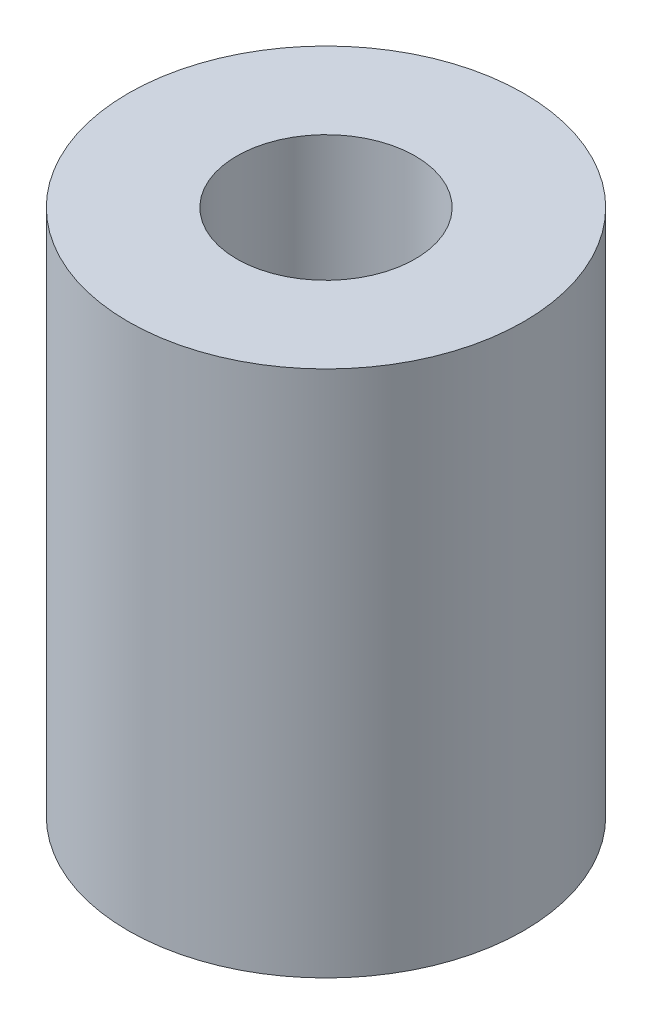
from build123d import *

# Parameters (mm, degrees)
SKETCH1_R           = 11.083333333
SKETCH1_R_2         = 5
BOSS_EXTRUDE3_DEPTH = 14.777777778


with BuildPart() as part:
    # Sketch1 → Boss-Extrude3 (new, symmetric)
    with BuildSketch(Plane(origin=(0, 0, 0), x_dir=(1, 0, 0), z_dir=(0, 1, 0))):
        with Locations(Location((0, 0, 0), (0, 0, 270))):
            Circle(SKETCH1_R)
        with Locations(Location((0, 0, 0), (0, 0, 270))):
            Circle(SKETCH1_R_2, mode=Mode.SUBTRACT)
    extrude(amount=BOSS_EXTRUDE3_DEPTH, both=True)


solid = part.part
